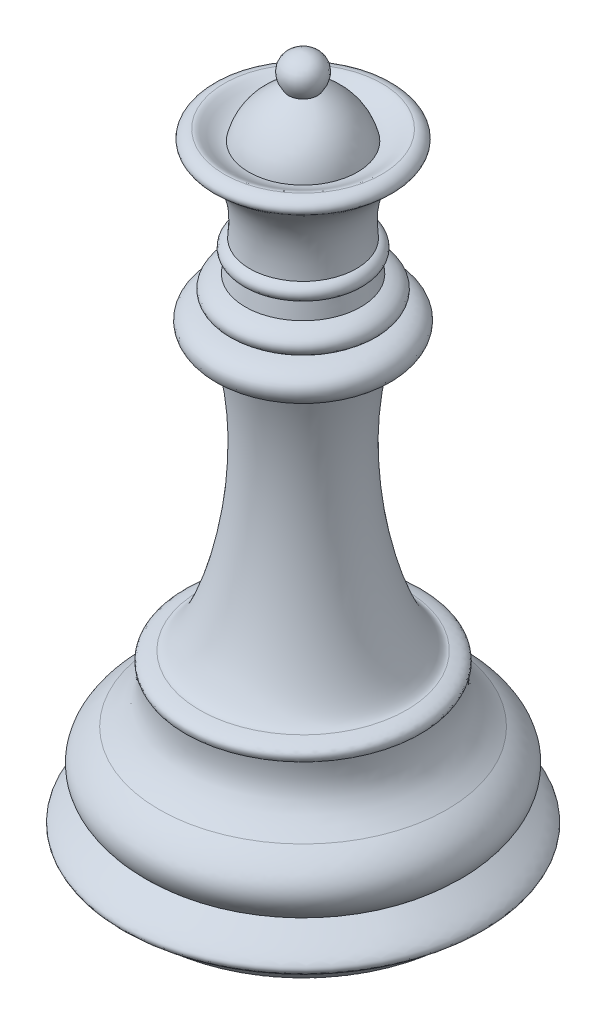
from build123d import *

# Parameters (mm, degrees)
SCALE1_SCALE = 0.5


with BuildPart() as part:
    # Sketch1 → Revolve1 (revolve)
    with BuildSketch(Plane.XY, mode=Mode.PRIVATE) as revolve1_sk:
        with BuildLine():
            Line((0, 0), (140.774968358, 0))
            add(Edge.make_bspline(
                [(140.774968358, 0), (155.234122408, 3.231654353), (159.377913863, 13.158393745), (191.911767627, 35.698596386), (193.048899491, 34.526021511), (155.283504354, 59.910385095)],
                knots=[0, 0, 0, 0, 0.22247768, 0.32247768, 1, 1, 1, 1], degree=3))
            add(Edge.make_bspline(
                [(155.283504354, 59.910385095), (182.106764993, 81.617228835), (174.956954962, 102.688823354), (147.29307916, 119.766158716)],
                knots=[0, 0, 0, 0, 1, 1, 1, 1], degree=3))
            add(Edge.make_bspline(
                [(147.29307916, 119.766158716), (124.433884012, 136.256844929), (118.124910662, 147.750231163), (120.295974312, 173.412440284)],
                knots=[0, 0, 0, 0, 1, 1, 1, 1], degree=3))
            add(Edge.make_bspline(
                [(120.295974312, 173.412440284), (125.004881342, 181.626575868), (117.994177575, 184.940048835), (105.889274464, 187.272050264)],
                knots=[0, 0, 0, 0, 1, 1, 1, 1], degree=3))
            add(Edge.make_bspline(
                [(66.641318891, 464.759111319), (30.651749093, 340.508784271), (82.842322366, 188.46596197), (105.889274464, 187.272050264)],
                knots=[0, 0, 0, 0, 1, 1, 1, 1], degree=3))
            Line((66.641318891, 464.759111319), (78.18604581, 464.759111319))
            add(Edge.make_bspline(
                [(78.18604581, 464.759111319), (94.273045171, 464.543230059), (107.822521829, 494.463412066), (66.043746092, 496.867628316)],
                knots=[0, 0, 0, 0, 1, 1, 1, 1], degree=3))
            add(Edge.make_bspline(
                [(66.043746092, 496.867628316), (81.500151243, 502.395831618), (81.80535012, 516.079555261), (59.191489814, 521.425295914)],
                knots=[0, 0, 0, 0, 1, 1, 1, 1], degree=3))
            Line((59.191489814, 521.425295914), (56.513172204, 536.995107568))
            add(Edge.make_bspline(
                [(56.513172204, 536.995107568), (65.725878486, 541.828298811), (63.054327938, 550.692982201), (54.674508381, 553.110237843)],
                knots=[0, 0, 0, 0, 1, 1, 1, 1], degree=3))
            add(Edge.make_bspline(
                [(54.674508381, 553.110237843), (50.366476624, 592.959696224), (60.365203866, 615.145323799), (89.496625618, 636.459206946)],
                knots=[0, 0, 0, 0, 1, 1, 1, 1], degree=3))
            add(Edge.make_bspline(
                [(89.496625618, 636.459206946), (96.290534049, 641.715443957), (88.56475714, 649.623679939), (80.688827032, 649.787761816)],
                knots=[0, 0, 0, 0, 1, 1, 1, 1], degree=3))
            add(Edge.make_bspline(
                [(80.688827032, 649.787761816), (74.807415588, 650.21208279), (68.37154299, 641.514102672), (55.579293319, 639.130453665)],
                knots=[0, 0, 0, 0, 1, 1, 1, 1], degree=3))
            add(Edge.make_bspline(
                [(55.579293319, 639.130453665), (48.256663859, 669.288442413), (14.825689712, 686.597595329)],
                knots=[0, 0, 0, 1, 1, 1], degree=2))
            add(Edge.make_bspline(
                [(14.825689712, 686.597595329), (26.149261957, 702.228532085), (17.740227393, 717.400219489), (0, 718.369889382)],
                knots=[0, 0, 0, 0, 1, 1, 1, 1], degree=3))
            Line((0, 718.369889382), (0, 0))
        make_face()
    revolve(revolve1_sk.sketch.rotate(Axis((0, 718.369889382, 0), (0, -1, 0)), 90), axis=Axis((0, 718.369889382, 0), (0, -1, 0)))


with BuildPart() as part_1:
    # Scale1: scaled about (0, 0, 0)
    add(part.part.scale(SCALE1_SCALE))


solid = part_1.part
